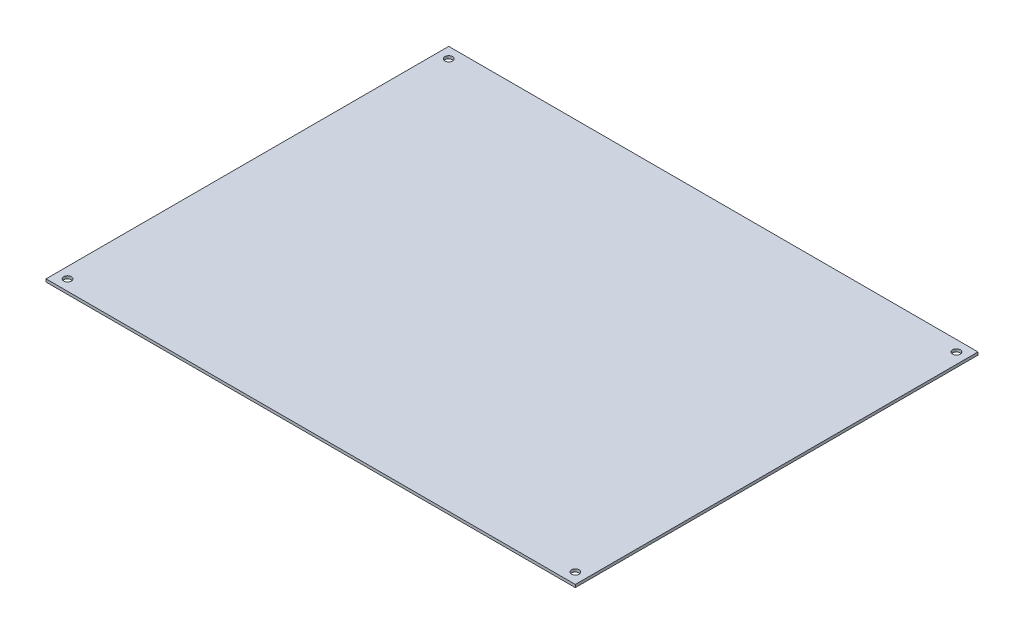
from build123d import *

# Parameters (mm, degrees)
SKETCH4_W               = 380.5
SKETCH4_H               = 289.5
BOSS_EXTRUDE1_DEPTH     = 2
SKETCH5_R               = 2.75
CUT_EXTRUDE1_DEPTH      = 240.064060452
MIRROR2_COPY_1_SKETCH_R = 2.75
MIRROR2_COPY_1_DEPTH    = 240.064060452


with BuildPart() as part:
    # Sketch4 → Boss-Extrude1 (new body)
    with BuildSketch(Plane(origin=(0, 0, 0), x_dir=(1, 0, 0), z_dir=(0, 1, 0))):
        Rectangle(SKETCH4_W, SKETCH4_H)
    extrude(amount=BOSS_EXTRUDE1_DEPTH)

    # Sketch5 → Cut-Extrude1 (cut, through all)
    with BuildSketch(Plane(origin=(0, 2, 0), x_dir=(1, 0, 0), z_dir=(0, 1, 0))):
        with Locations(Location((182.5, 137, 0), (0, 0, 270))):
            Circle(SKETCH5_R)
    cut_extrude1 = extrude(amount=-CUT_EXTRUDE1_DEPTH, mode=Mode.SUBTRACT)

    # Mirror1: Cut-Extrude1 across plane
    add(cut_extrude1.mirror(Plane(origin=(0, 0, 0), x_dir=(0, 0, 1), z_dir=(1, 0, 0))), mode=Mode.SUBTRACT)

    # Mirror2: Cut-Extrude1 across plane
    add(cut_extrude1.mirror(Plane.XY), mode=Mode.SUBTRACT)

    # Mirror2 copy 1 sketch → Mirror2 copy 1 (cut, through all)
    with BuildSketch(Plane(origin=(0, 2, 0), x_dir=(-1, 0, 0), z_dir=(0, 1, 0))):
        with Locations(Location((182.5, 137, 0), (0, 0, 270))):
            Circle(MIRROR2_COPY_1_SKETCH_R)
    extrude(amount=-MIRROR2_COPY_1_DEPTH, mode=Mode.SUBTRACT)


solid = part.part
